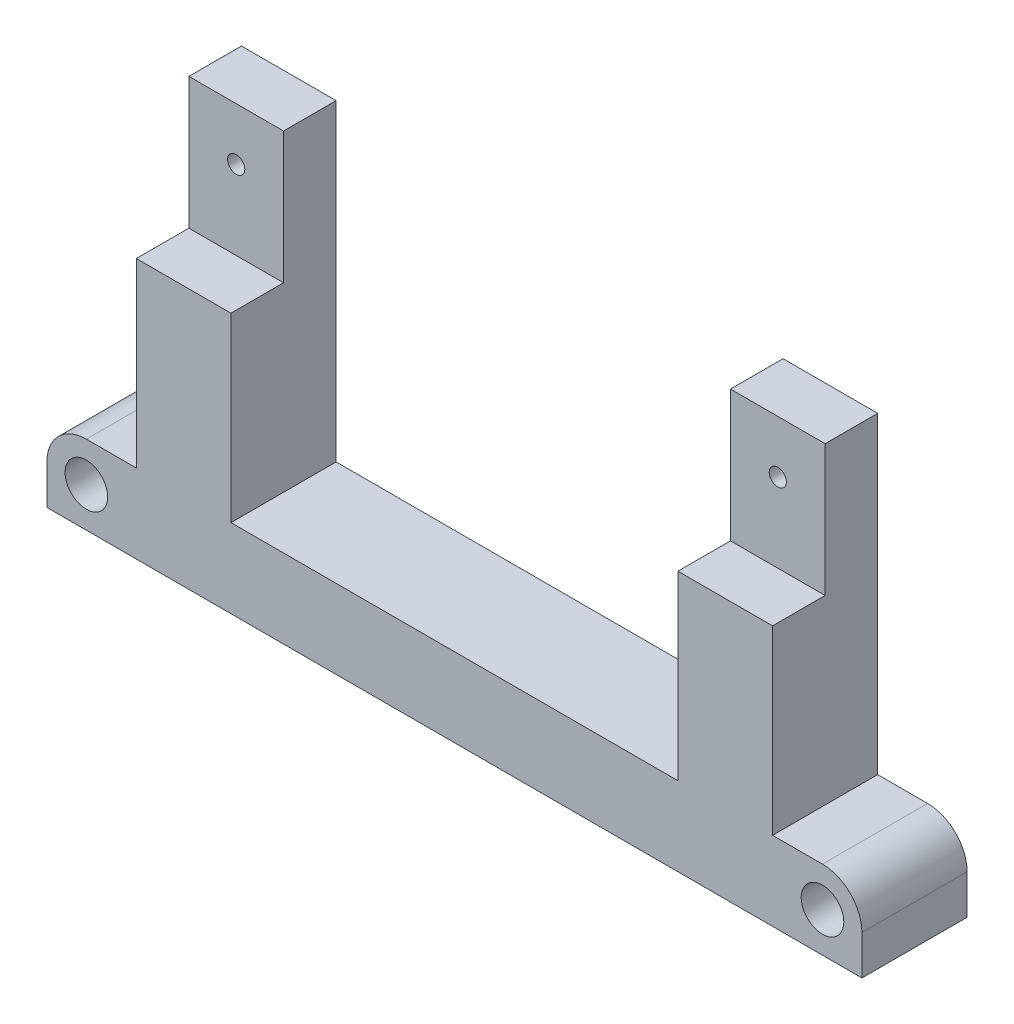
from build123d import *

# Parameters (mm, degrees)
SKETCH1_R             = 4.05
BOSS_EXTRUDE1_DEPTH   = 10
SKETCH2_W             = 18
SKETCH2_H             = 10
BOSS_EXTRUDE2_DEPTH   = 25
F_4_CLEARANCE_HOLE1_D = 3.2639


with BuildPart() as part:
    # Sketch1 → Boss-Extrude1 (new, symmetric)
    with BuildSketch(Plane.XY):
        with BuildLine():
            Line((-77.5, 0), (77.5, 0))
            Line((77.5, 0), (77.5, 7.5))
            ThreePointArc((77.5, 7.5), (75.303300859, 12.803300859), (70, 15))
            Line((70, 15), (60.5, 15))
            Line((60.5, 15), (60.5, 49.5))
            Line((60.5, 49.5), (42.5, 49.5))
            Line((42.5, 49.5), (42.5, 15))
            Line((42.5, 15), (-42.5, 15))
            Line((-42.5, 15), (-42.5, 49.5))
            Line((-42.5, 49.5), (-60.5, 49.5))
            Line((-60.5, 49.5), (-60.5, 15))
            Line((-60.5, 15), (-70, 15))
            ThreePointArc((-70, 15), (-75.303300859, 12.803300859), (-77.5, 7.5))
            Line((-77.5, 7.5), (-77.5, 0))
        make_face()
        with Locations((-70, 7.5)):
            Circle(SKETCH1_R, mode=Mode.SUBTRACT)
        with Locations((70, 7.5)):
            Circle(SKETCH1_R, mode=Mode.SUBTRACT)
    extrude(amount=BOSS_EXTRUDE1_DEPTH, both=True)

    # Sketch2 → Boss-Extrude2 (add)
    with BuildSketch(Plane(origin=(0, 49.5, 0), x_dir=(1, 0, 0), z_dir=(0, 1, 0))):
        with Locations((51.5, 5)):
            Rectangle(SKETCH2_W, SKETCH2_H)
        with Locations((-51.5, 5)):
            Rectangle(SKETCH2_W, SKETCH2_H)
    extrude(amount=BOSS_EXTRUDE2_DEPTH)

    # #4 Clearance Hole1 (through all)
    with Locations(Plane.XY):
        with Locations((-51.5, 64.5), (51.5, 64.5)):
            Hole(F_4_CLEARANCE_HOLE1_D / 2)


solid = part.part
